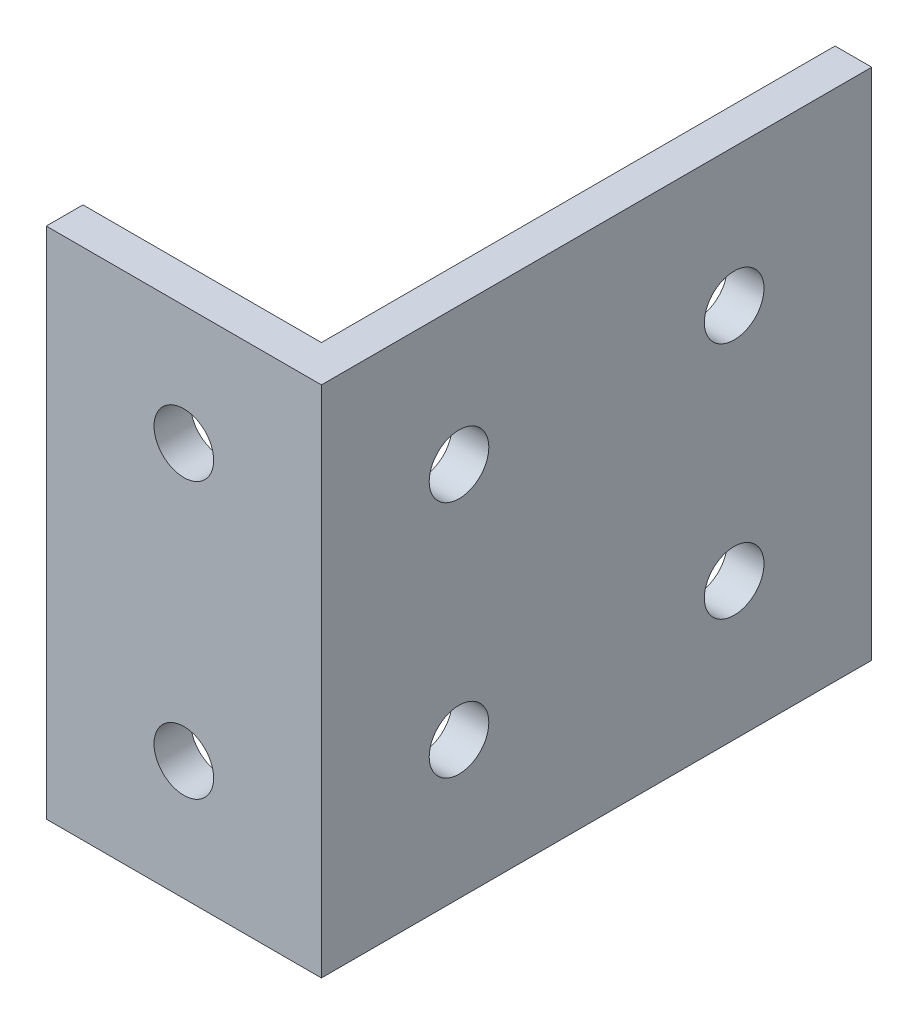
from build123d import *

# Parameters (mm, degrees)
EXTRUDE_1_DEPTH          = 56
CUT_EXTRUDE_1_DEPTH      = 85.687661439
CUT_EXTRUDE_1_DEPTH_BACK = 85.687661439
SKETCH_2_R               = 3.25
CUT_EXTRUDE_2_DEPTH      = 88.3842091
CUT_EXTRUDE_2_DEPTH_BACK = 88.3842091
SKETCH_3_R               = 3.25


with BuildPart() as part:
    # 草图1 → 凸台-拉伸1 (new body)
    with BuildSketch(Plane(origin=(0, 0, 0), x_dir=(1, 0, 0), z_dir=(0, 1, 0))):
        Polygon((0, 0), (-30, 0), (-30, 4), (-4, 4), (-4, 60), (0, 60), align=None)
    extrude(amount=EXTRUDE_1_DEPTH)

    # 草图2 → 切除-拉伸1 (cut, two sides: drawn at the far end of the back side and taken through both)
    with BuildSketch(Plane(origin=(0, 0, -4), x_dir=(-1, 0, 0), z_dir=(0, 0, -1)).offset(-CUT_EXTRUDE_1_DEPTH_BACK)):
        with Locations((15, 43)):
            Circle(SKETCH_2_R)
        with Locations((15, 13)):
            Circle(SKETCH_2_R)
    extrude(amount=CUT_EXTRUDE_1_DEPTH + CUT_EXTRUDE_1_DEPTH_BACK, mode=Mode.SUBTRACT)

    # 草图3 → 切除-拉伸2 (cut, two sides: drawn at the far end of the back side and taken through both)
    with BuildSketch(Plane(origin=(0, 0, 0), x_dir=(0, 0, -1), z_dir=(1, 0, 0)).offset(-CUT_EXTRUDE_2_DEPTH_BACK)):
        with Locations((15, 41)):
            Circle(SKETCH_3_R)
        with Locations((15, 15)):
            Circle(SKETCH_3_R)
        with Locations((45, 15)):
            Circle(SKETCH_3_R)
        with Locations((45, 41)):
            Circle(SKETCH_3_R)
    extrude(amount=CUT_EXTRUDE_2_DEPTH + CUT_EXTRUDE_2_DEPTH_BACK, mode=Mode.SUBTRACT)


solid = part.part
